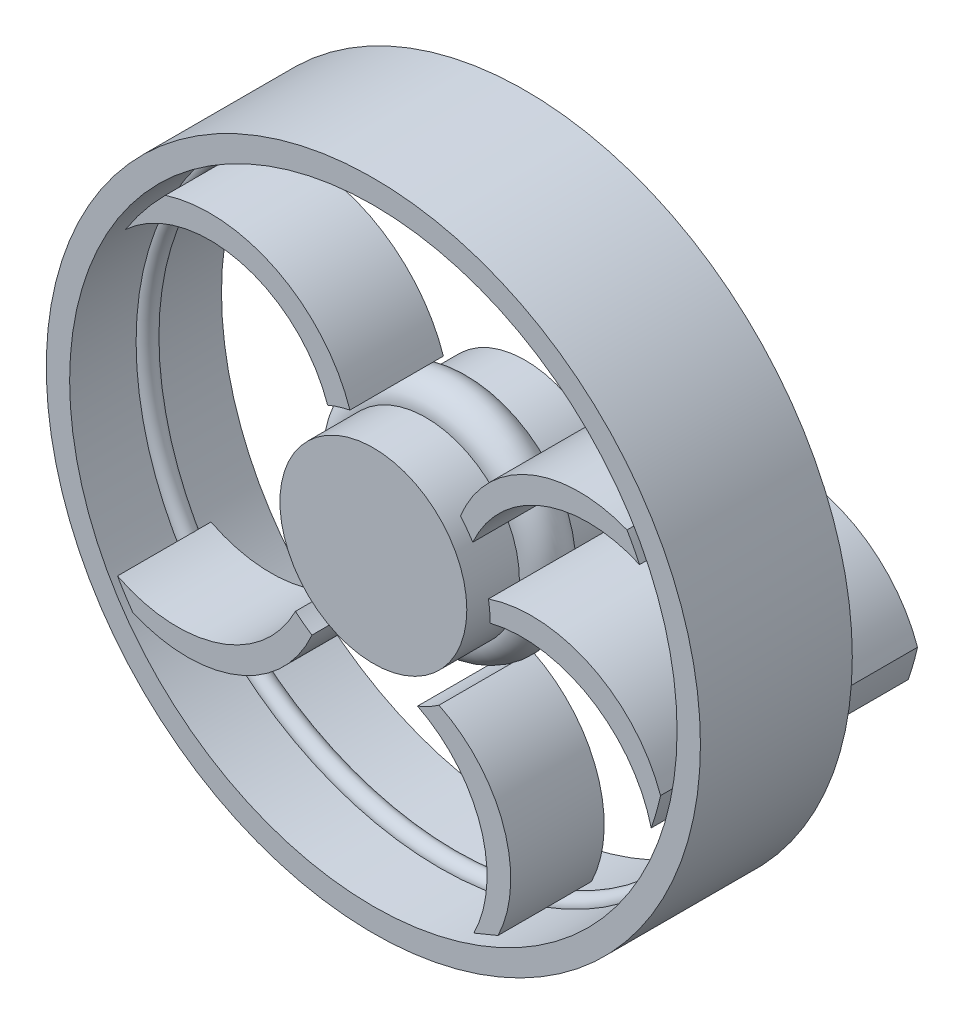
from build123d import *

# Parameters (mm, degrees)
BOSS_EXTRUDE2_DEPTH = 40
BOSS_EXTRUDE3_DEPTH = 110
BOSS_EXTRUDE4_DEPTH = 40
BOSS_EXTRUDE5_DEPTH = 40
BOSS_EXTRUDE6_DEPTH = 40


with BuildPart() as part:
    # Sketch1 → Revolve3 (revolve)
    with BuildSketch(Plane(origin=(0, 0, 0), x_dir=(1, 0, 0), z_dir=(0, 1, 0))):
        with BuildLine():
            Line((0, 0), (0, 65))
            Line((0, 65), (40, 65))
            Line((40, 65), (40, 42.5))
            ThreePointArc((40, 42.5), (50, 32.5), (40, 22.5))
            Line((40, 22.5), (40, 0))
            Line((40, 0), (0, 0))
        make_face()
        with BuildLine():
            Line((130, 36.551745653), (130, 65))
            Line((130, 65), (140, 65))
            Line((140, 65), (140, 0))
            Line((140, 0), (130, 0))
            Line((130, 0), (130, 28.448254347))
            ThreePointArc((130, 28.448254347), (125.948254347, 32.5), (130, 36.551745653))
        make_face()
    revolve(axis=Axis((0, 0, 0), (0, 0, -1)))


with BuildPart() as body_2:
    # Sketch2 → Boss-Extrude2 (new body)
    with BuildSketch(Plane.XY):
        with BuildLine():
            ThreePointArc((-89.038527845, 89.079196967), (-41.335108568, 85.179792965), (-10.016367123, 48.986451082))
            ThreePointArc((-10.016367123, 48.986451082), (-14.866374615, 47.7387778), (-19.56724703, 46.012203204))
            ThreePointArc((-19.56724703, 46.012203204), (-56.885182963, 80.396223361), (-106.06928282, 67.913695343))
            ThreePointArc((-106.06928282, 67.913695343), (-98.126240427, 78.956973806), (-89.038527845, 89.079196967))
        make_face()
    extrude(amount=-BOSS_EXTRUDE2_DEPTH)


with BuildPart() as body_3:
    # Sketch5 → Boss-Extrude3 (new body)
    with BuildSketch(Plane.XY):
        with BuildLine():
            ThreePointArc((50, 0), (93.050676183, -6.448972777), (118.931988865, -41.450510223))
            ThreePointArc((118.931988865, -41.450510223), (121.12803337, -34.510321717), (122.919460364, -27.454854525))
            ThreePointArc((122.919460364, -27.454854525), (93.468634985, 5.660563455), (49.250896673, 8.622596878))
            ThreePointArc((49.250896673, 8.622596878), (49.812372126, 4.327537773), (50, 0))
        make_face()
    extrude(amount=-BOSS_EXTRUDE3_DEPTH)


with BuildPart() as body_4:
    # Sketch6 → Boss-Extrude4 (new body)
    with BuildSketch(Plane.XY):
        with BuildLine():
            ThreePointArc((-33.334867895, -37.266427014), (-66.244925523, -65.524764115), (-109.497512234, -62.235501024))
            ThreePointArc((-109.497512234, -62.235501024), (-106.382577731, -67.42188019), (-103.022181799, -72.452693741))
            ThreePointArc((-103.022181799, -72.452693741), (-58.451779697, -73.393299216), (-26.270637621, -42.542374158))
            ThreePointArc((-26.270637621, -42.542374158), (-29.919274331, -40.060417166), (-33.334867895, -37.266427014))
        make_face()
    extrude(amount=-BOSS_EXTRUDE4_DEPTH)


with BuildPart() as body_5:
    # Sketch7 → Boss-Extrude5 (new body)
    with BuildSketch(Plane.XY):
        with BuildLine():
            ThreePointArc((37.266427014, 33.334867895), (66.599765306, 63.355287149), (108.569209756, 63.84112676))
            ThreePointArc((108.569209756, 63.84112676), (111.370895488, 58.817398881), (113.940281582, 53.670988496))
            ThreePointArc((113.940281582, 53.670988496), (72.566529397, 54.757803848), (42.542374158, 26.270637621))
            ThreePointArc((42.542374158, 26.270637621), (40.060417166, 29.919274331), (37.266427014, 33.334867895))
        make_face()
    extrude(amount=-BOSS_EXTRUDE5_DEPTH)


with BuildPart() as body_6:
    # Sketch8 → Boss-Extrude6 (new body)
    with BuildSketch(Plane.XY):
        with BuildLine():
            Line((43.012559071, -118.376021792), (53.371321769, -114.077641304))
            ThreePointArc((53.371321769, -114.077641304), (55.784014775, -72.485996849), (28.080312525, -41.370231429))
            ThreePointArc((28.080312525, -41.370231429), (23.621596051, -44.068358263), (18.906254171, -46.28772573))
            ThreePointArc((18.906254171, -46.28772573), (45.881676765, -77.341871034), (43.012559071, -118.376021792))
        make_face()
    extrude(amount=-BOSS_EXTRUDE6_DEPTH)


solid = Compound([part.part, body_2.part, body_3.part, body_4.part, body_5.part, body_6.part])
